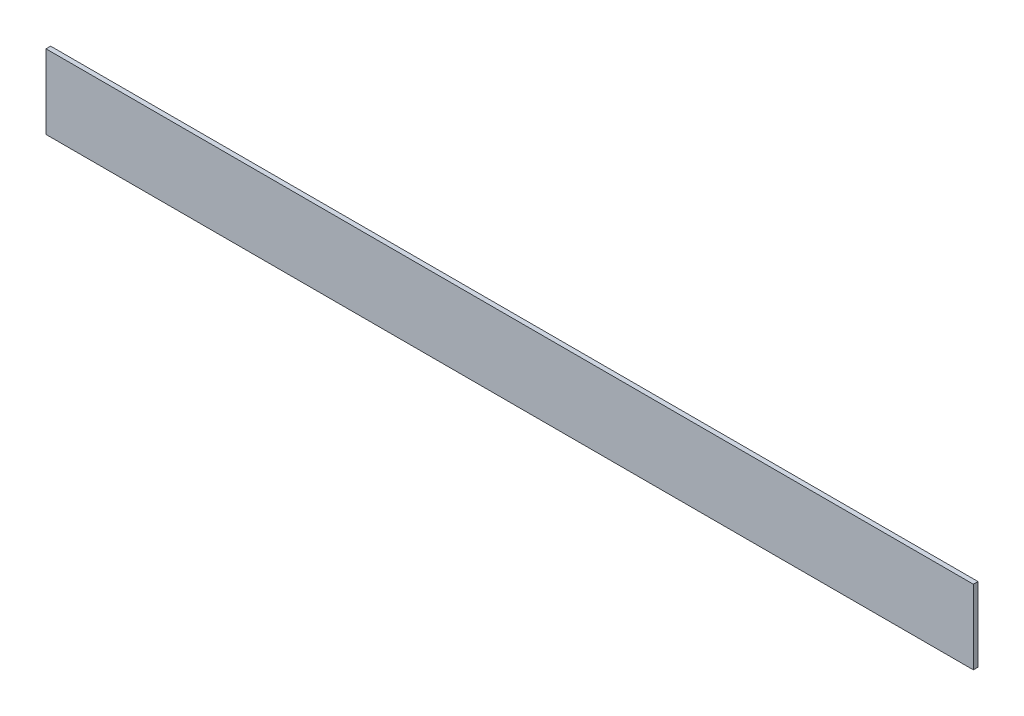
from build123d import *

# Parameters (mm, degrees)
SKETCH1_W           = 317.5
SKETCH1_H           = 25.4
BOSS_EXTRUDE1_DEPTH = 1.5875


with BuildPart() as part:
    # Sketch1 → Boss-Extrude1 (new body)
    with BuildSketch(Plane.XY):
        with Locations((-158.75, -12.7)):
            Rectangle(SKETCH1_W, SKETCH1_H)
    extrude(amount=BOSS_EXTRUDE1_DEPTH)


solid = part.part
